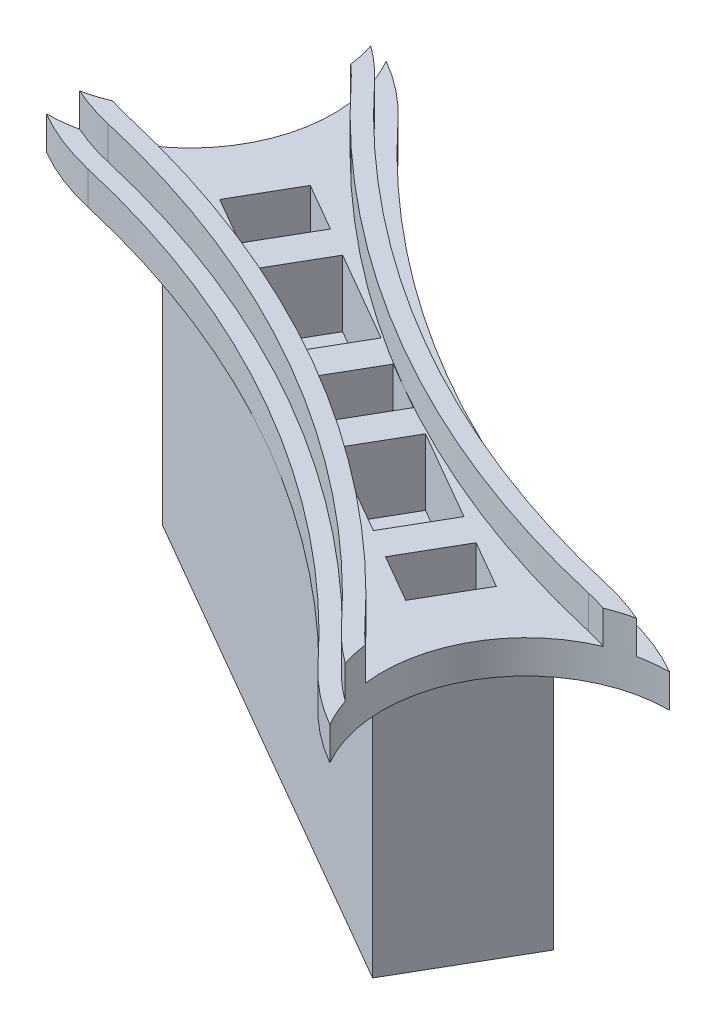
from build123d import *

# Parameters (mm, degrees)
BOSS_EXTRUDE1_DEPTH  = 3
BOSS_EXTRUDE4_DEPTH  = 3
SKETCH11_R           = 13
CUT_EXTRUDE2_DEPTH   = 6.5
BOSS_EXTRUDE5_DEPTH  = 3
CUT_EXTRUDE3_DEPTH   = 24
BOSS_EXTRUDE6_DEPTH  = 3
BOSS_EXTRUDE7_DEPTH  = 6
CUT_EXTRUDE4_DEPTH   = 3
BOSS_EXTRUDE8_DEPTH  = 12
BOSS_EXTRUDE10_DEPTH = 3
BOSS_EXTRUDE11_DEPTH = 3
SKETCH21_W           = 9
SKETCH21_H           = 6
CUT_EXTRUDE5_DEPTH   = 5


with BuildPart() as part:
    # Sketch3 → Boss-Extrude1 (new body)
    with BuildSketch(Plane(origin=(0, 0, 0), x_dir=(1, 0, 0), z_dir=(0, 1, 0))):
        with BuildLine():
            ThreePointArc((-3.439345798, 89.282032024), (-25.956006297, 89.282032024), (-14.697676047, 69.782032024))
            ThreePointArc((-14.697676047, 69.782032024), (-5.505287892, 73.589643868), (-1.697676047, 82.782032024))
            ThreePointArc((-1.697676047, 82.782032024), (-2.140640306, 86.14667961), (-3.439345798, 89.282032024))
        make_face()
        with BuildLine():
            ThreePointArc((-3.439345798, 89.282032024), (-0.67063629, 87.395724301), (1.787544185, 85.119486633))
            ThreePointArc((1.787544185, 85.119486633), (24.283086066, 67.204681754), (51.045533135, 56.680373453))
            ThreePointArc((51.045533135, 56.680373453), (54.245903018, 55.689645548), (57.26384818, 54.23502664))
            ThreePointArc((57.26384818, 54.23502664), (46.005517931, 47.73502664), (46.005517931, 34.73502664))
            ThreePointArc((46.005517931, 34.73502664), (43.236808422, 36.621334362), (40.778627947, 38.89757203))
            ThreePointArc((40.778627947, 38.89757203), (18.283086066, 56.812376909), (-8.479361003, 67.336685211))
            ThreePointArc((-8.479361003, 67.336685211), (-11.679730886, 68.327413115), (-14.697676047, 69.782032024))
            ThreePointArc((-14.697676047, 69.782032024), (-3.439345798, 76.282032024), (-3.439345798, 89.282032024))
        make_face()
        with BuildLine():
            ThreePointArc((57.26384818, 54.23502664), (46.005517931, 47.73502664), (46.005517931, 34.73502664))
            ThreePointArc((46.005517931, 34.73502664), (60.628495766, 28.677990898), (70.26384818, 41.23502664))
            ThreePointArc((70.26384818, 41.23502664), (66.456236335, 50.427414795), (57.26384818, 54.23502664))
        make_face()
    extrude(amount=BOSS_EXTRUDE1_DEPTH)

    # Sketch10 → Boss-Extrude4 (add)
    with BuildSketch(Plane(origin=(0, 3, 0), x_dir=(1, 0, 0), z_dir=(0, 1, 0))):
        with BuildLine():
            ThreePointArc((-4.545374861, 88.183955812), (-24.656968191, 88.532032024), (-14.299728684, 71.288919395))
            ThreePointArc((-14.299728684, 71.288919395), (-11.320648952, 69.799088737), (-8.143608603, 68.798625813))
            ThreePointArc((-8.143608603, 68.798625813), (19.033086066, 58.111415015), (41.876829448, 39.91931244))
            ThreePointArc((41.876829448, 39.91931244), (44.33177593, 37.66814625), (47.111546993, 35.833102851))
            ThreePointArc((47.111546993, 35.833102851), (67.223140323, 35.48502664), (56.865900817, 52.728139268))
            ThreePointArc((56.865900817, 52.728139268), (53.886821084, 54.217969926), (50.709780735, 55.21843285))
            ThreePointArc((50.709780735, 55.21843285), (23.533086066, 65.905643649), (0.689342684, 84.097746224))
            ThreePointArc((0.689342684, 84.097746224), (-1.765603798, 86.348912413), (-4.545374861, 88.183955812))
        make_face()
        with BuildLine():
            ThreePointArc((-5.671220706, 87.085879601), (-23.357930085, 87.782032024), (-13.911689713, 72.812968603))
            ThreePointArc((-13.911689713, 72.812968603), (-10.968716852, 71.276238274), (-7.807856203, 70.260566416))
            ThreePointArc((-7.807856203, 70.260566416), (19.783086066, 59.41045312), (42.975030949, 40.941052849))
            ThreePointArc((42.975030949, 40.941052849), (45.435058904, 38.711503158), (48.237392838, 36.931179062))
            ThreePointArc((48.237392838, 36.931179062), (65.924102218, 36.23502664), (56.477861845, 51.20409006))
            ThreePointArc((56.477861845, 51.20409006), (53.534888984, 52.740820389), (50.374028335, 53.756492247))
            ThreePointArc((50.374028335, 53.756492247), (22.783086066, 64.606605543), (-0.408858816, 83.076005814))
            ThreePointArc((-0.408858816, 83.076005814), (-2.868886772, 85.305555505), (-5.671220706, 87.085879601))
        make_face(mode=Mode.SUBTRACT)
    extrude(amount=BOSS_EXTRUDE4_DEPTH)

    # Sketch11 → Cut-Extrude2 (cut, symmetric)
    with BuildSketch(Plane(origin=(0, 3, 0), x_dir=(1, 0, 0), z_dir=(0, 1, 0))):
        with Locations((-14.697676047, 82.782032024)):
            Circle(SKETCH11_R)
        with Locations((57.26384818, 41.23502664)):
            Circle(SKETCH11_R)
    extrude(amount=CUT_EXTRUDE2_DEPTH, both=True, mode=Mode.SUBTRACT)

    # Sketch12 → Boss-Extrude5 (add)
    with BuildSketch(Plane.XZ):
        Polygon((-4.233574432, -69.812376909), (1.766425568, -80.204681754), (46.799746565, -54.204681754), (40.799746565, -43.812376909), align=None)
        Polygon((2.864501779, -76.106605543), (42.701670353, -53.106605543), (39.701670353, -47.91045312), (-0.135498221, -70.91045312), align=None, mode=Mode.SUBTRACT)
    extrude(amount=BOSS_EXTRUDE5_DEPTH)

    # Sketch13 → Cut-Extrude3 (cut)
    with BuildSketch(Plane.XZ):
        Polygon((39.701670353, -47.91045312), (-0.135498221, -70.91045312), (2.864501779, -76.106605543), (42.701670353, -53.106605543), align=None)
    extrude(amount=-CUT_EXTRUDE3_DEPTH, mode=Mode.SUBTRACT)

    # Sketch14 → Boss-Extrude6 (add)
    with BuildSketch(Plane.XZ.offset(3)):
        Polygon((40.799746565, -43.812376909), (-4.233574432, -69.812376909), (1.766425568, -80.204681754), (46.799746565, -54.204681754), align=None)
    extrude(amount=BOSS_EXTRUDE6_DEPTH)

    # Sketch15 → Boss-Extrude7 (add)
    with BuildSketch(Plane(origin=(0, -3, 0), x_dir=(1, 0, 0), z_dir=(0, 1, 0))):
        Polygon((4.194628798, 68.41045312), (6.792705009, 66.91045312), (9.792705009, 72.106605543), (7.194628798, 73.606605543), align=None)
        Polygon((18.019946345, 67.356605543), (15.019946345, 62.16045312), (17.618022557, 60.66045312), (20.618022557, 65.856605543), align=None)
        Polygon((24.948149576, 63.356605543), (21.948149576, 58.16045312), (24.546225787, 56.66045312), (27.546225787, 61.856605543), align=None)
        Polygon((35.773467123, 57.106605543), (32.773467123, 51.91045312), (35.371543334, 50.41045312), (38.371543334, 55.606605543), align=None)
    extrude(amount=BOSS_EXTRUDE7_DEPTH)

    # Sketch16 → Cut-Extrude4 (cut)
    with BuildSketch(Plane(origin=(0, -3, 0), x_dir=(1, 0, 0), z_dir=(0, 1, 0))):
        Polygon((42.701670353, 53.106605543), (38.371543334, 55.606605543), (35.371543334, 50.41045312), (39.701670353, 47.91045312), align=None)
        Polygon((24.948149576, 63.356605543), (20.618022557, 65.856605543), (17.618022557, 60.66045312), (21.948149576, 58.16045312), align=None)
        Polygon((-0.135498221, 70.91045312), (4.194628798, 68.41045312), (7.194628798, 73.606605543), (2.864501779, 76.106605543), align=None)
    extrude(amount=-CUT_EXTRUDE4_DEPTH, mode=Mode.SUBTRACT)

    # Sketch17 → Boss-Extrude8 (add)
    with BuildSketch(Plane.XZ.offset(6)):
        Polygon((46.799746565, -54.204681754), (40.799746565, -43.812376909), (-4.233574432, -69.812376909), (1.766425568, -80.204681754), align=None)
        Polygon((42.701670353, -53.106605543), (39.701670353, -47.91045312), (-0.135498221, -70.91045312), (2.864501779, -76.106605543), align=None, mode=Mode.SUBTRACT)
    extrude(amount=BOSS_EXTRUDE8_DEPTH)

    # Sketch19 → Boss-Extrude10 (add)
    with BuildSketch(Plane.XZ.offset(18)):
        Polygon((2.315463673, -78.155643649), (44.750708459, -53.655643649), (40.250708459, -45.861415015), (-2.184536327, -70.361415015), (-3.483574432, -71.111415015), (-4.233574432, -69.812376909), (40.799746565, -43.812376909), (46.799746565, -54.204681754), (1.766425568, -80.204681754), (1.016425568, -78.905643649), align=None)
    extrude(amount=BOSS_EXTRUDE10_DEPTH)

    # Sketch20 → Boss-Extrude11 (add)
    with BuildSketch(Plane.XZ.offset(21)):
        Polygon((1.766425568, -80.204681754), (46.799746565, -54.204681754), (40.799746565, -43.812376909), (-4.233574432, -69.812376909), align=None)
        Polygon((42.701670353, -53.106605543), (39.701670353, -47.91045312), (-0.135498221, -70.91045312), (2.864501779, -76.106605543), align=None, mode=Mode.SUBTRACT)
    extrude(amount=BOSS_EXTRUDE11_DEPTH)

    # Sketch21 → Cut-Extrude5 (cut)
    with BuildSketch(Plane(origin=(-33.404826775, 0, -19.286285731), x_dir=(-0.5000000000000008, 0, 0.8660254037844383), z_dir=(-0.8660254037844382, 0, -0.5000000000000007))):
        with Locations((-64.342504686, -15)):
            Rectangle(SKETCH21_W, SKETCH21_H)
    extrude(amount=-CUT_EXTRUDE5_DEPTH, mode=Mode.SUBTRACT)


solid = part.part
